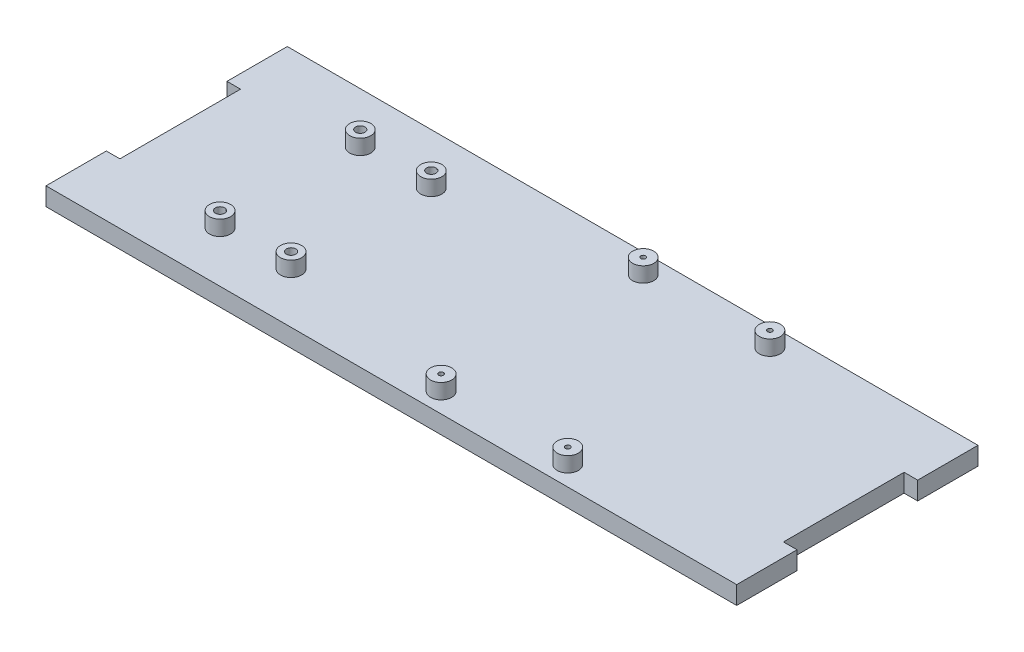
from build123d import *

# Parameters (mm, degrees)
SKETCH2_W                                  = 220
SKETCH2_H                                  = 80
MAIN_DEPTH                                 = 6
SKETCH3_W                                  = 20
SKETCH3_H                                  = 6
TAB_DEPTH                                  = 4.5
MIRROR1_AT_THE_SECOND_PLANE_COPY_1_SKETC_W = 20
MIRROR1_AT_THE_SECOND_PLANE_COPY_1_SKETC_H = 6
MIRROR1_AT_THE_SECOND_PLANE_COPY_1_DEPTH   = 4.5
SKETCH4_R                                  = 0.8
SKETCH4_R_2                                = 1.55
PCB_HOLES_DEPTH                            = 122.434138528
PCB_START                                  = 5
SKETCH5_R                                  = 3.5
SKETCH5_R_2                                = 1.55
SKETCH5_R_3                                = 0.8
PCB_PEGS_DEPTH                             = 5


with BuildPart() as part:
    # Sketch2 → Main (new body)
    with BuildSketch(Plane(origin=(0, 0, 0), x_dir=(1, 0, 0), z_dir=(0, 1, 0))):
        Rectangle(SKETCH2_W, SKETCH2_H)
    extrude(amount=MAIN_DEPTH)

    # Sketch3 → Tab (add)
    with BuildSketch(Plane(origin=(110, 0, 0), x_dir=(0, 0, -1), z_dir=(1, 0, 0))):
        with Locations((30, 3)):
            Rectangle(SKETCH3_W, SKETCH3_H)
    tab = extrude(amount=TAB_DEPTH)

    # Mirror1: Tab across plane
    add(tab.mirror(Plane(origin=(0, 0, 0), x_dir=(0, 0, 1), z_dir=(1, 0, 0))))

    # Mirror1 at the second plane: Tab across plane
    add(tab.mirror(Plane.XY))

    # Mirror1 at the second plane copy 1 sketc → Mirror1 at the second plane copy 1 (add)
    with BuildSketch(Plane.ZY.offset(110)):
        with Locations((30, 3)):
            Rectangle(MIRROR1_AT_THE_SECOND_PLANE_COPY_1_SKETC_W, MIRROR1_AT_THE_SECOND_PLANE_COPY_1_SKETC_H)
    extrude(amount=MIRROR1_AT_THE_SECOND_PLANE_COPY_1_DEPTH)

    # Sketch4 → PCB holes (cut, through all)
    with BuildSketch(Plane(origin=(0, 6, 0), x_dir=(1, 0, 0), z_dir=(0, 1, 0))):
        with Locations(Location((10, 33.5, 0), (0, 0, 270))):
            Circle(SKETCH4_R)
        with Locations(Location((52, 33.5, 0), (0, 0, 270))):
            Circle(SKETCH4_R)
        with Locations(Location((52, -33.5, 0), (0, 0, 270))):
            Circle(SKETCH4_R)
        with Locations(Location((10, -33.5, 0), (0, 0, 270))):
            Circle(SKETCH4_R)
        with Locations(Location((-73.55, 23.25, 0), (0, 0, 270))):
            Circle(SKETCH4_R_2)
        with Locations(Location((-50, 23.25, 0), (0, 0, 270))):
            Circle(SKETCH4_R_2)
        with Locations(Location((-50, -23.25, 0), (0, 0, 270))):
            Circle(SKETCH4_R_2)
        with Locations(Location((-73.55, -23.25, 0), (0, 0, 270))):
            Circle(SKETCH4_R_2)
    extrude(amount=-PCB_HOLES_DEPTH, mode=Mode.SUBTRACT)

    # Sketch5 → PCB pegs (add)
    # profile 1 of 8: a face of its own
    with BuildSketch(Plane(origin=(0, 6, 0), x_dir=(1, 0, 0), z_dir=(0, 1, 0)).offset(PCB_START)):
        with Locations(Location((-73.55, 23.25, 0), (0, 0, 270))):
            Circle(SKETCH5_R)
        with Locations(Location((-73.55, 23.25, 0), (0, 0, 270))):
            Circle(SKETCH5_R_2, mode=Mode.SUBTRACT)
    # profile 2 of 8: a face of its own
    with BuildSketch(Plane(origin=(0, 6, 0), x_dir=(1, 0, 0), z_dir=(0, 1, 0)).offset(PCB_START)):
        with Locations(Location((-50, 23.25, 0), (0, 0, 270))):
            Circle(SKETCH5_R)
        with Locations(Location((-50, 23.25, 0), (0, 0, 270))):
            Circle(SKETCH5_R_2, mode=Mode.SUBTRACT)
    # profile 3 of 8: a face of its own
    with BuildSketch(Plane(origin=(0, 6, 0), x_dir=(1, 0, 0), z_dir=(0, 1, 0)).offset(PCB_START)):
        with Locations(Location((-73.55, -23.25, 0), (0, 0, 270))):
            Circle(SKETCH5_R)
        with Locations(Location((-73.55, -23.25, 0), (0, 0, 270))):
            Circle(SKETCH5_R_2, mode=Mode.SUBTRACT)
    # profile 4 of 8: a face of its own
    with BuildSketch(Plane(origin=(0, 6, 0), x_dir=(1, 0, 0), z_dir=(0, 1, 0)).offset(PCB_START)):
        with Locations(Location((-50, -23.25, 0), (0, 0, 270))):
            Circle(SKETCH5_R)
        with Locations(Location((-50, -23.25, 0), (0, 0, 270))):
            Circle(SKETCH5_R_2, mode=Mode.SUBTRACT)
    # profile 5 of 8: a face of its own
    with BuildSketch(Plane(origin=(0, 6, 0), x_dir=(1, 0, 0), z_dir=(0, 1, 0)).offset(PCB_START)):
        with Locations(Location((10, -33.5, 0), (0, 0, 270))):
            Circle(SKETCH5_R)
        with Locations(Location((10, -33.5, 0), (0, 0, 270))):
            Circle(SKETCH5_R_3, mode=Mode.SUBTRACT)
    # profile 6 of 8: a face of its own
    with BuildSketch(Plane(origin=(0, 6, 0), x_dir=(1, 0, 0), z_dir=(0, 1, 0)).offset(PCB_START)):
        with Locations(Location((52, -33.5, 0), (0, 0, 270))):
            Circle(SKETCH5_R)
        with Locations(Location((52, -33.5, 0), (0, 0, 270))):
            Circle(SKETCH5_R_3, mode=Mode.SUBTRACT)
    # profile 7 of 8: a face of its own
    with BuildSketch(Plane(origin=(0, 6, 0), x_dir=(1, 0, 0), z_dir=(0, 1, 0)).offset(PCB_START)):
        with Locations(Location((52, 33.5, 0), (0, 0, 270))):
            Circle(SKETCH5_R)
        with Locations(Location((52, 33.5, 0), (0, 0, 270))):
            Circle(SKETCH5_R_3, mode=Mode.SUBTRACT)
    # profile 8 of 8: a face of its own
    with BuildSketch(Plane(origin=(0, 6, 0), x_dir=(1, 0, 0), z_dir=(0, 1, 0)).offset(PCB_START)):
        with Locations(Location((10, 33.5, 0), (0, 0, 270))):
            Circle(SKETCH5_R)
        with Locations(Location((10, 33.5, 0), (0, 0, 270))):
            Circle(SKETCH5_R_3, mode=Mode.SUBTRACT)
    extrude(amount=-PCB_PEGS_DEPTH)


solid = part.part
